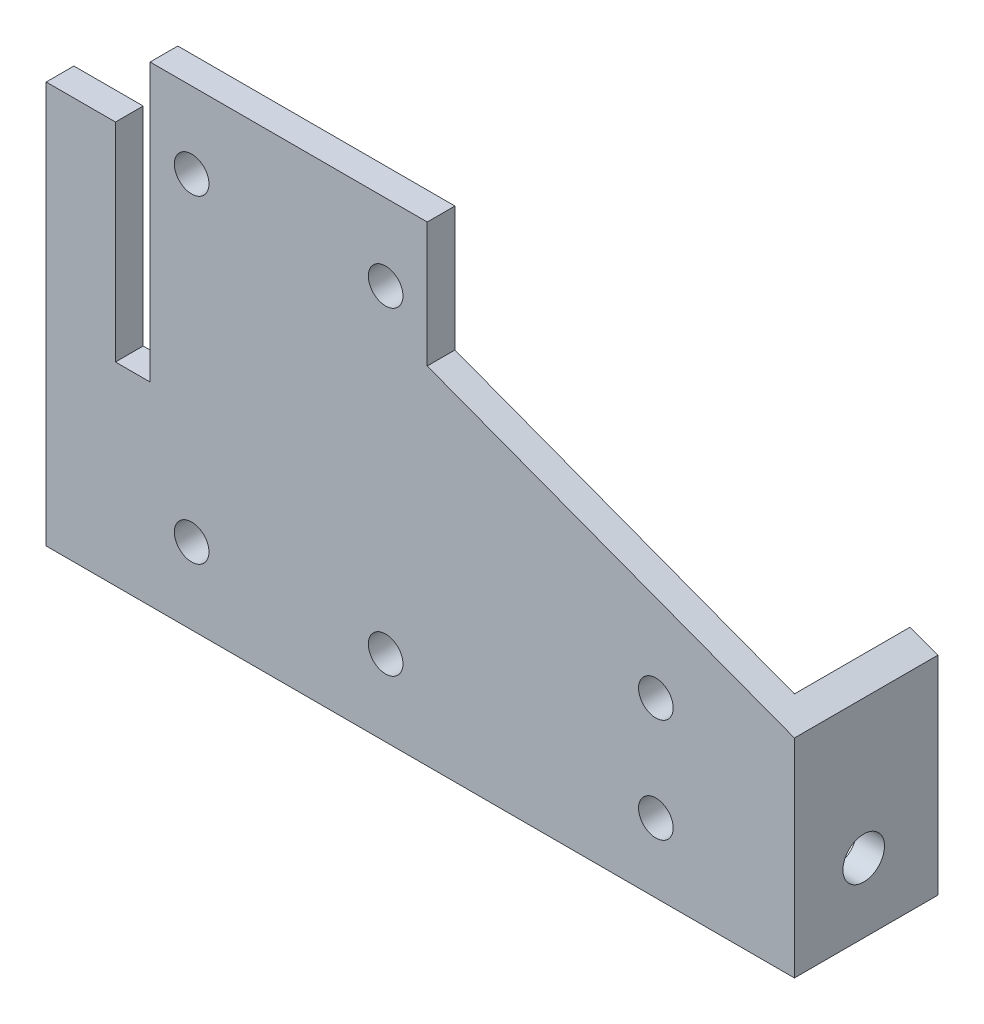
from build123d import *

# Parameters (mm, degrees)
SKETCH_1_R          = 2.5
EXTRUDE_1_DEPTH     = 4
EXTRUDE_2_DEPTH     = 20.7
SKETCH_3_R          = 3
CUT_EXTRUDE_1_DEPTH = 6.7
CUT_EXTRUDE_2_DEPTH = 10


with BuildPart() as part:
    # Эскиз1 → Бобышка-Вытянуть1 (new body)
    with BuildSketch(Plane.XY):
        Polygon((0, 0), (108, 0), (108, 30), (55, 50), (55, 68), (0, 68), align=None)
        with Locations((21, 57)):
            Circle(SKETCH_1_R, mode=Mode.SUBTRACT)
        with Locations((49, 57)):
            Circle(SKETCH_1_R, mode=Mode.SUBTRACT)
        with Locations((21, 11)):
            Circle(SKETCH_1_R, mode=Mode.SUBTRACT)
        with Locations((49, 11)):
            Circle(SKETCH_1_R, mode=Mode.SUBTRACT)
        with Locations((88, 10)):
            Circle(SKETCH_1_R, mode=Mode.SUBTRACT)
        with Locations((88, 25)):
            Circle(SKETCH_1_R, mode=Mode.SUBTRACT)
    extrude(amount=EXTRUDE_1_DEPTH)

    # Эскиз2 → Бобышка-Вытянуть2 (add)
    with BuildSketch(Plane.XY.offset(4)):
        Polygon((108, 0), (104, 0), (104, 31.509433962), (108, 30), align=None)
    extrude(amount=-EXTRUDE_2_DEPTH)

    # Эскиз3 → Вырез-Вытянуть1 (cut)
    with BuildSketch(Plane(origin=(108, 0, 0), x_dir=(0, 0, -1), z_dir=(1, 0, 0))):
        with Locations((6, 10)):
            Circle(SKETCH_3_R)
    extrude(amount=-CUT_EXTRUDE_1_DEPTH, mode=Mode.SUBTRACT)

    # Эскиз4 → Вырез-Вытянуть2 (cut)
    with BuildSketch(Plane(origin=(0, 0, 0), x_dir=(-1, 0, 0), z_dir=(0, 0, -1))):
        Polygon((0, 68), (-15, 68), (-15, 48), (-15, 28), (-10, 28), (-10, 58), (0, 58), align=None)
    extrude(amount=-CUT_EXTRUDE_2_DEPTH, mode=Mode.SUBTRACT)


solid = part.part
